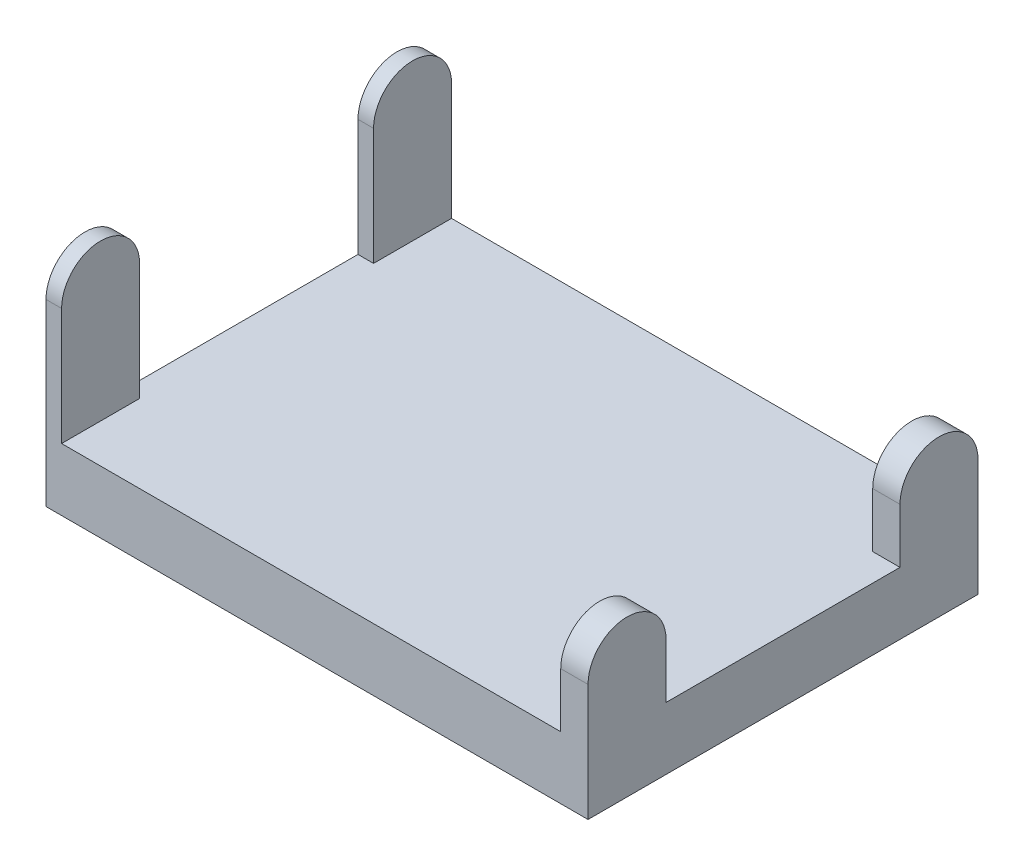
from build123d import *

# Parameters (mm, degrees)
SKETCH1_W           = 34.75
SKETCH1_H           = 25
BOSS_EXTRUDE1_DEPTH = 4
SKETCH2_W           = 1.75
SKETCH2_H           = 5
BOSS_EXTRUDE2_DEPTH = 6
SKETCH4_W           = 1
SKETCH4_H           = 5
BOSS_EXTRUDE3_DEPTH = 10
FILLET2_RADIUS      = 2.5
FILLET2_LENGTH      = 1
FILLET3_RADIUS      = 2.5
FILLET3_LENGTH      = 1
FILLET4_RADIUS      = 2.5
FILLET4_LENGTH      = 1.75
FILLET5_RADIUS      = 2.5
FILLET5_LENGTH      = 1.75


with BuildPart() as part:
    # Sketch1 → Boss-Extrude1 (new body)
    with BuildSketch(Plane(origin=(0, 0, 0), x_dir=(1, 0, 0), z_dir=(0, 1, 0))):
        Rectangle(SKETCH1_W, SKETCH1_H)
    extrude(amount=BOSS_EXTRUDE1_DEPTH)

    # Sketch2 → Boss-Extrude2 (add)
    with BuildSketch(Plane(origin=(0, 4, 0), x_dir=(1, 0, 0), z_dir=(0, 1, 0))):
        with Locations((16.5, -10)):
            Rectangle(SKETCH2_W, SKETCH2_H)
        with Locations((16.5, 10)):
            Rectangle(SKETCH2_W, SKETCH2_H)
    extrude(amount=BOSS_EXTRUDE2_DEPTH)

    # Sketch4 → Boss-Extrude3 (add)
    with BuildSketch(Plane(origin=(0, 4, 0), x_dir=(1, 0, 0), z_dir=(0, 1, 0))):
        with Locations((-16.875, 10)):
            Rectangle(SKETCH4_W, SKETCH4_H)
        with Locations((-16.875, -10)):
            Rectangle(SKETCH4_W, SKETCH4_H)
    extrude(amount=BOSS_EXTRUDE3_DEPTH)

    # Fillet2: full round fillet: the end face becomes a half cylinder, R = half its width
    fillet2_face = Plane((-16.875, 14, -10), x_dir=(1, 0, 0), z_dir=(0, 1, 0))  # on the end face: x along it, z out of the body
    fillet2_slab = fillet2_face.offset(-FILLET2_RADIUS / 2) * Box(FILLET2_LENGTH, 2 * FILLET2_RADIUS, FILLET2_RADIUS, mode=Mode.PRIVATE)  # the body's end, R deep
    fillet2_round = Plane((-16.875, 11.5, -10), x_dir=(0, 1, 0), z_dir=(1, 0, 0)) * Cylinder(FILLET2_RADIUS, FILLET2_LENGTH, mode=Mode.PRIVATE)  # its axis R under the face
    add(fillet2_slab - fillet2_round, mode=Mode.SUBTRACT)

    # Fillet3: full round fillet: the end face becomes a half cylinder, R = half its width
    fillet3_face = Plane((-16.875, 14, 10), x_dir=(1, 0, 0), z_dir=(0, 1, 0))  # on the end face: x along it, z out of the body
    fillet3_slab = fillet3_face.offset(-FILLET3_RADIUS / 2) * Box(FILLET3_LENGTH, 2 * FILLET3_RADIUS, FILLET3_RADIUS, mode=Mode.PRIVATE)  # the body's end, R deep
    fillet3_round = Plane((-16.875, 11.5, 10), x_dir=(0, 1, 0), z_dir=(1, 0, 0)) * Cylinder(FILLET3_RADIUS, FILLET3_LENGTH, mode=Mode.PRIVATE)  # its axis R under the face
    add(fillet3_slab - fillet3_round, mode=Mode.SUBTRACT)

    # Fillet4: full round fillet: the end face becomes a half cylinder, R = half its width
    fillet4_face = Plane((16.5, 10, -10), x_dir=(1, 0, 0), z_dir=(0, 1, 0))  # on the end face: x along it, z out of the body
    fillet4_slab = fillet4_face.offset(-FILLET4_RADIUS / 2) * Box(FILLET4_LENGTH, 2 * FILLET4_RADIUS, FILLET4_RADIUS, mode=Mode.PRIVATE)  # the body's end, R deep
    fillet4_round = Plane((16.5, 7.5, -10), x_dir=(0, 1, 0), z_dir=(1, 0, 0)) * Cylinder(FILLET4_RADIUS, FILLET4_LENGTH, mode=Mode.PRIVATE)  # its axis R under the face
    add(fillet4_slab - fillet4_round, mode=Mode.SUBTRACT)

    # Fillet5: full round fillet: the end face becomes a half cylinder, R = half its width
    fillet5_face = Plane((16.5, 10, 10), x_dir=(1, 0, 0), z_dir=(0, 1, 0))  # on the end face: x along it, z out of the body
    fillet5_slab = fillet5_face.offset(-FILLET5_RADIUS / 2) * Box(FILLET5_LENGTH, 2 * FILLET5_RADIUS, FILLET5_RADIUS, mode=Mode.PRIVATE)  # the body's end, R deep
    fillet5_round = Plane((16.5, 7.5, 10), x_dir=(0, 1, 0), z_dir=(1, 0, 0)) * Cylinder(FILLET5_RADIUS, FILLET5_LENGTH, mode=Mode.PRIVATE)  # its axis R under the face
    add(fillet5_slab - fillet5_round, mode=Mode.SUBTRACT)


solid = part.part
